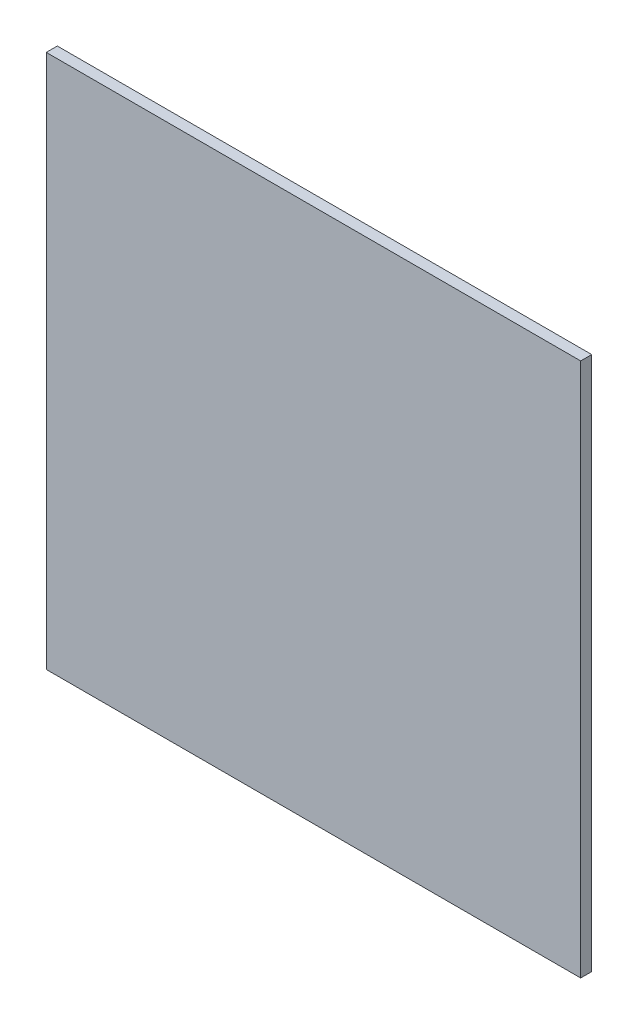
from build123d import *

# Parameters (mm, degrees)
SKETCH_1_W        = 145
SKETCH_1_H        = 145
EXTRUDE_267_DEPTH = 3


with BuildPart() as part:
    # Эскиз1 → Extrude 267 (new body)
    with BuildSketch(Plane.XY):
        Rectangle(SKETCH_1_W, SKETCH_1_H)
    extrude(amount=EXTRUDE_267_DEPTH)


solid = part.part
